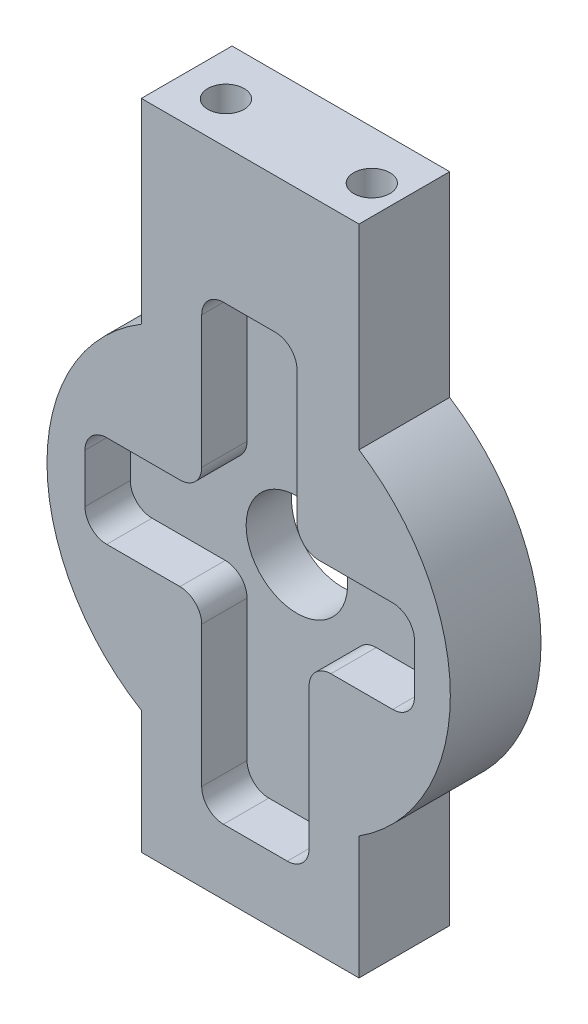
from build123d import *

# Parameters (mm, degrees)
SKETCH1_R           = 2.8
BOSS_EXTRUDE1_DEPTH = 5
CUT_EXTRUDE1_DEPTH  = 2.5
FILLET1_R           = 1.2
SKETCH3_R           = 1
CUT_EXTRUDE2_DEPTH  = 8
SKETCH4_R           = 1
CUT_EXTRUDE3_DEPTH  = 8


with BuildPart() as part:
    # Sketch1 → Boss-Extrude1 (new body)
    with BuildSketch(Plane.XY.offset(10)):
        with BuildLine():
            Line((-253, 244), (-241, 244))
            Line((-241, 244), (-241, 233.219543457))
            ThreePointArc((-241, 233.219543457), (-235.964643127, 224), (-241, 214.780456543))
            Line((-241, 214.780456543), (-241, 208))
            Line((-241, 208), (-253, 208))
            Line((-253, 208), (-253, 214.780456543))
            ThreePointArc((-253, 214.780456543), (-258.20228405, 224), (-253, 233.219543457))
            Line((-253, 233.219543457), (-253, 244))
        make_face()
        with Locations((-246.922635101, 224)):
            Circle(SKETCH1_R, mode=Mode.SUBTRACT)
    extrude(amount=BOSS_EXTRUDE1_DEPTH)

    # Sketch2 → Cut-Extrude1 (cut)
    with BuildSketch(Plane.XY.offset(15)):
        Polygon((-249.671711, 236.526764937), (-244.414971283, 236.526764937), (-244.414971283, 226.843297037), (-237.940881316, 226.843297037), (-237.940881316, 221.752559627), (-243.750962055, 221.752559627), (-243.750962055, 211.604094919), (-249.671711, 211.604094919), (-249.671711, 221.752559627), (-256.108895334, 221.752559627), (-256.108895334, 226.843297037), (-249.671711, 226.843297037), align=None)
    extrude(amount=-CUT_EXTRUDE1_DEPTH, mode=Mode.SUBTRACT)

    # Fillet1
    fillet1_edges = [part.edges().sort_by_distance(p)[0] for p in [
        (-249.671711, 226.843297037, 13.75),
        (-249.671711, 236.526764937, 13.75),
        (-244.414971283, 236.526764937, 13.75),
        (-244.414971283, 226.843297037, 13.75),
        (-237.940881316, 226.843297037, 13.75),
        (-237.940881316, 221.752559627, 13.75),
        (-243.750962055, 221.752559627, 13.75),
        (-243.750962055, 211.604094919, 13.75),
        (-249.671711, 211.604094919, 13.75),
        (-249.671711, 221.752559627, 13.75),
        (-256.108895334, 221.752559627, 13.75),
        (-256.108895334, 226.843297037, 13.75),
    ]]
    fillet(fillet1_edges, radius=FILLET1_R)

    # Sketch3 → Cut-Extrude2 (cut)
    with BuildSketch(Plane(origin=(0, 208, 0), x_dir=(-1, 0, 0), z_dir=(0, -1, 0))):
        with Locations(Location((250.9, -12.2, 0), (0, 0, 90))):
            Circle(SKETCH3_R)
        with Locations(Location((242.9, -12.2, 0), (0, 0, 90))):
            Circle(SKETCH3_R)
    extrude(amount=-CUT_EXTRUDE2_DEPTH, mode=Mode.SUBTRACT)

    # Sketch4 → Cut-Extrude3 (cut)
    with BuildSketch(Plane(origin=(0, 244, 0), x_dir=(1, 0, 0), z_dir=(0, 1, 0))):
        with Locations(Location((-242.598801613, -12.694978247, 0), (0, 0, 270))):
            Circle(SKETCH4_R)
        with Locations(Location((-250.64051394, -12.694978247, 0), (0, 0, 270))):
            Circle(SKETCH4_R)
    extrude(amount=-CUT_EXTRUDE3_DEPTH, mode=Mode.SUBTRACT)


solid = part.part
